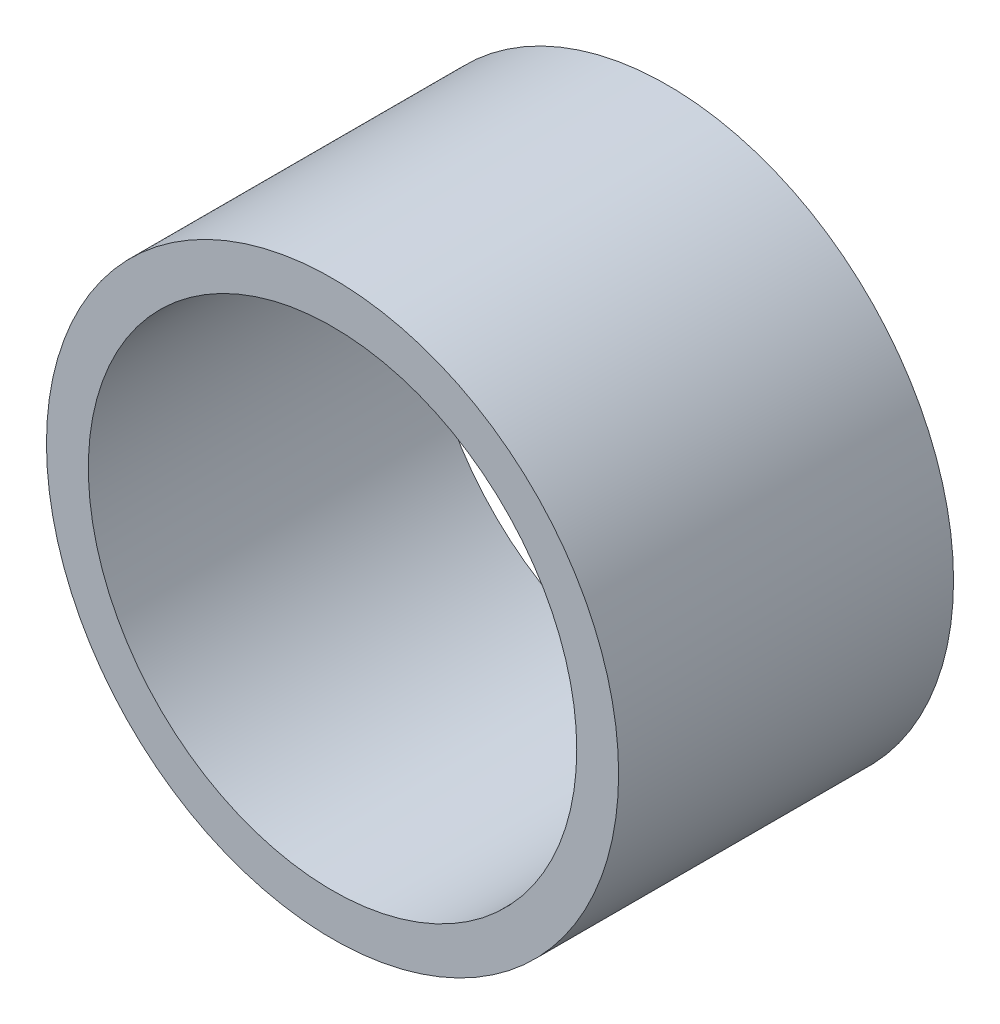
from build123d import *

# Parameters (mm, degrees)
SKETCH1_R           = 20.5
SKETCH1_R_2         = 17.5
BOSS_EXTRUDE1_DEPTH = 24


with BuildPart() as part:
    # Sketch1 → Boss-Extrude1 (new body)
    with BuildSketch(Plane.XY):
        Circle(SKETCH1_R)
        Circle(SKETCH1_R_2, mode=Mode.SUBTRACT)
    extrude(amount=BOSS_EXTRUDE1_DEPTH)


solid = part.part
